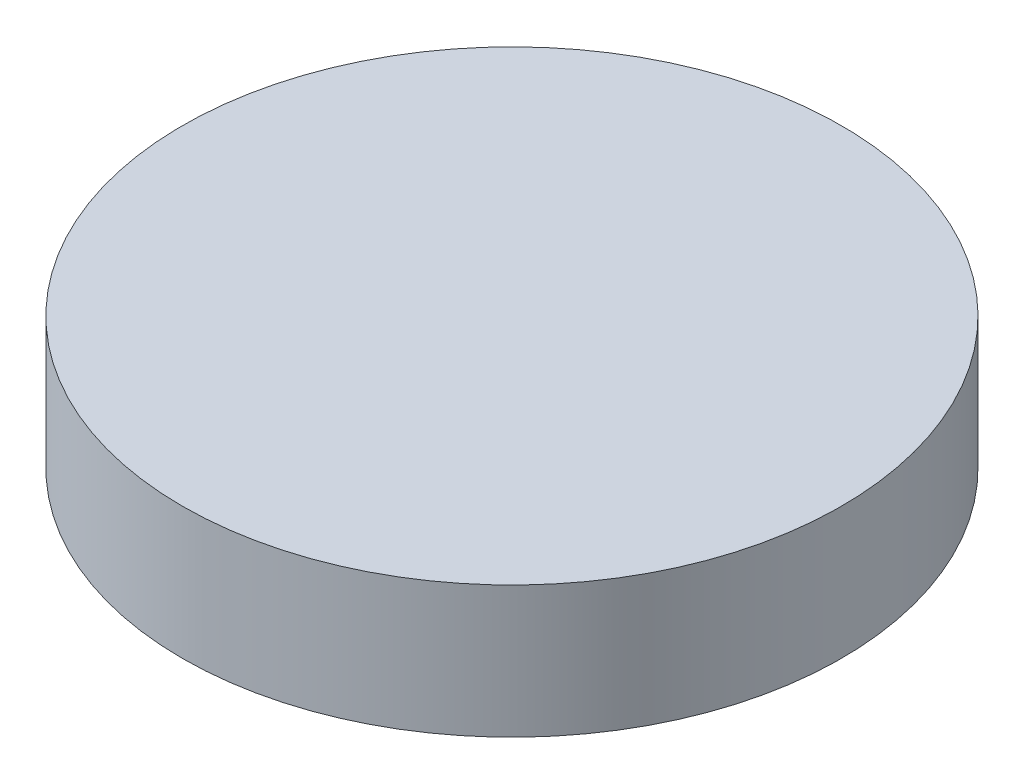
from build123d import *

# Parameters (mm, degrees)
SKETCH1_R           = 31.75
BOSS_EXTRUDE1_DEPTH = 12.7


with BuildPart() as part:
    # Sketch1 → Boss-Extrude1 (new body)
    with BuildSketch(Plane(origin=(0, 0, 0), x_dir=(1, 0, 0), z_dir=(0, 1, 0))):
        with Locations(Location((0, 0, 0), (0, 0, 270))):
            Circle(SKETCH1_R)
    extrude(amount=BOSS_EXTRUDE1_DEPTH)


solid = part.part
